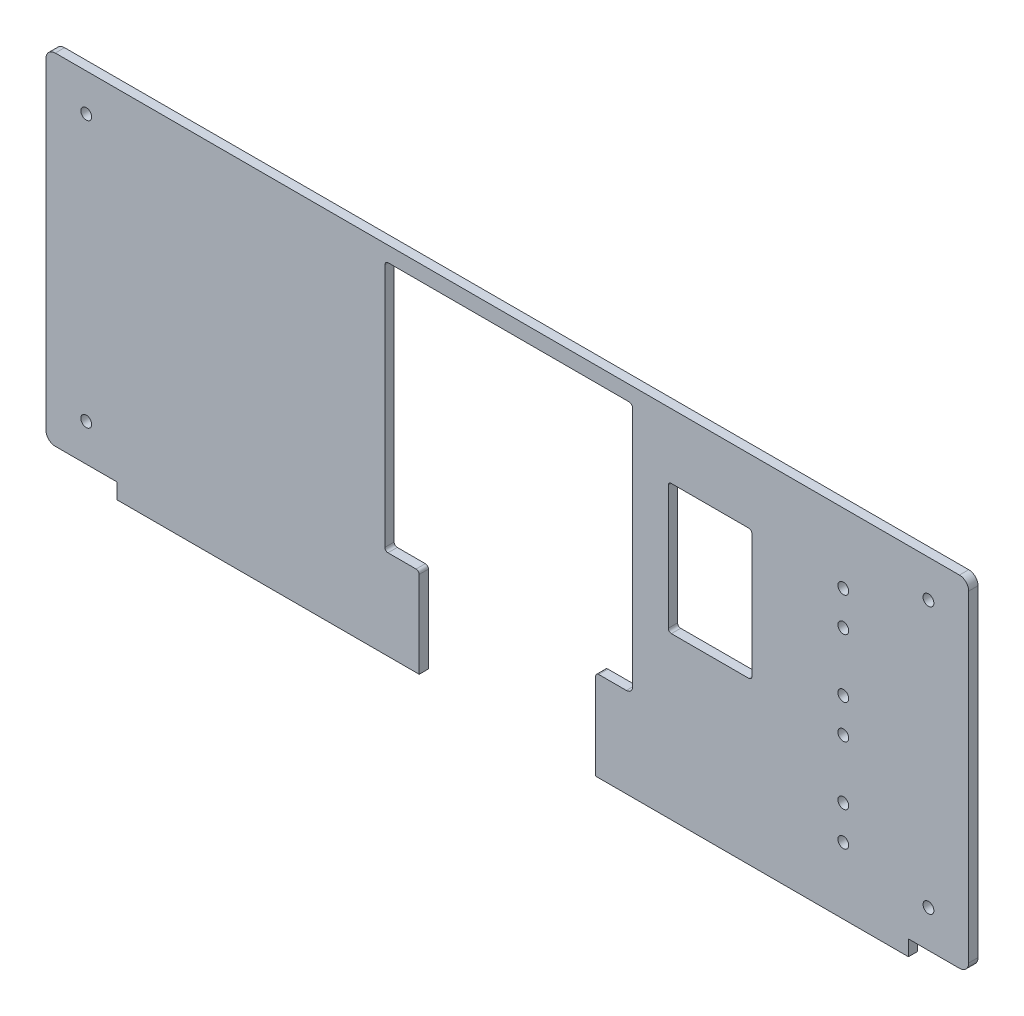
from build123d import *

# Parameters (mm, degrees)
SKETCH1_R           = 1.75
BOSS_EXTRUDE1_DEPTH = 3


with BuildPart() as part:
    # Sketch1 → Boss-Extrude1 (new body)
    with BuildSketch(Plane.XY):
        with BuildLine():
            Line((-146, 333.999999944), (146, 333.999999944))
            ThreePointArc((146, 333.999999944), (148.121320344, 333.121320287), (149, 330.999999944))
            Line((149, 330.999999944), (149, 226.999999944))
            ThreePointArc((149, 226.999999944), (148.121320344, 224.8786796), (146, 223.999999944))
            Line((146, 223.999999944), (129.53838912, 223.999999944))
            Line((129.53838912, 223.999999944), (129.53838912, 219))
            Line((129.53838912, 219), (73.53838912, 219))
            Line((73.53838912, 219), (28.510237275, 219))
            Line((28.510237275, 219), (28.510237275, 246.944274273))
            ThreePointArc((28.510237275, 246.944274273), (28.803130494, 247.651381054), (29.510237275, 247.944274273))
            Line((29.510237275, 247.944274273), (38.432325919, 247.944274273))
            ThreePointArc((38.432325919, 247.944274273), (39.846539481, 248.530060711), (40.432325919, 249.944274273))
            Line((40.432325919, 249.944274273), (40.432325919, 327.952168393))
            ThreePointArc((40.432325919, 327.952168393), (40.096133825, 328.763807906), (39.284494312, 329.1))
            Line((39.284494312, 329.1), (-38.419842474, 329.1))
            ThreePointArc((-38.419842474, 329.1), (-39.231481987, 328.763807906), (-39.567674081, 327.952168393))
            Line((-39.567674081, 327.952168393), (-39.567674081, 248.944274273))
            ThreePointArc((-39.567674081, 248.944274273), (-39.274780862, 248.237167492), (-38.567674081, 247.944274273))
            Line((-38.567674081, 247.944274273), (-29.469288178, 247.944274273))
            ThreePointArc((-29.469288178, 247.944274273), (-28.762181396, 247.651381054), (-28.469288178, 246.944274273))
            Line((-28.469288178, 246.944274273), (-28.469288178, 218.999999943))
            Line((-28.469288178, 218.999999943), (-70, 218.999999943))
            Line((-70, 218.999999943), (-126, 218.999999943))
            Line((-126, 218.999999943), (-126, 223.999999944))
            Line((-126, 223.999999944), (-146, 223.999999944))
            ThreePointArc((-146, 223.999999944), (-148.121320343, 224.8786796), (-149, 226.999999944))
            Line((-149, 226.999999944), (-149, 330.999999944))
            ThreePointArc((-149, 330.999999944), (-148.121320343, 333.121320287), (-146, 333.999999944))
        make_face()
        with Locations((-136, 321.999999944)):
            Circle(SKETCH1_R, mode=Mode.SUBTRACT)
        with Locations((-136, 235.999999944)):
            Circle(SKETCH1_R, mode=Mode.SUBTRACT)
        with Locations(Location((136, 235.999999944, 0), (0, 0, 180))):
            Circle(SKETCH1_R, mode=Mode.SUBTRACT)
        with Locations(Location((136, 321.999999944, 0), (0, 0, 180))):
            Circle(SKETCH1_R, mode=Mode.SUBTRACT)
        with Locations((108.5, 311.539999944)):
            Circle(SKETCH1_R, mode=Mode.SUBTRACT)
        with Locations((108.5, 300.499999944)):
            Circle(SKETCH1_R, mode=Mode.SUBTRACT)
        with Locations((108.5, 281.539999944)):
            Circle(SKETCH1_R, mode=Mode.SUBTRACT)
        with Locations((108.5, 270.499999944)):
            Circle(SKETCH1_R, mode=Mode.SUBTRACT)
        with Locations((108.5, 251.539999944)):
            Circle(SKETCH1_R, mode=Mode.SUBTRACT)
        with Locations((108.5, 240.499999944)):
            Circle(SKETCH1_R, mode=Mode.SUBTRACT)
        with BuildLine():
            Line((52.97092131, 313.1), (77.97092131, 313.1))
            ThreePointArc((77.97092131, 313.1), (78.678028091, 312.807106781), (78.97092131, 312.1))
            Line((78.97092131, 312.1), (78.97092131, 272.1))
            ThreePointArc((78.97092131, 272.1), (78.678028091, 271.392893219), (77.97092131, 271.1))
            Line((77.97092131, 271.1), (52.97092131, 271.1))
            ThreePointArc((52.97092131, 271.1), (52.263814529, 271.392893219), (51.97092131, 272.1))
            Line((51.97092131, 272.1), (51.97092131, 312.1))
            ThreePointArc((51.97092131, 312.1), (52.263814529, 312.807106781), (52.97092131, 313.1))
        make_face(mode=Mode.SUBTRACT)
    extrude(amount=BOSS_EXTRUDE1_DEPTH)


solid = part.part
